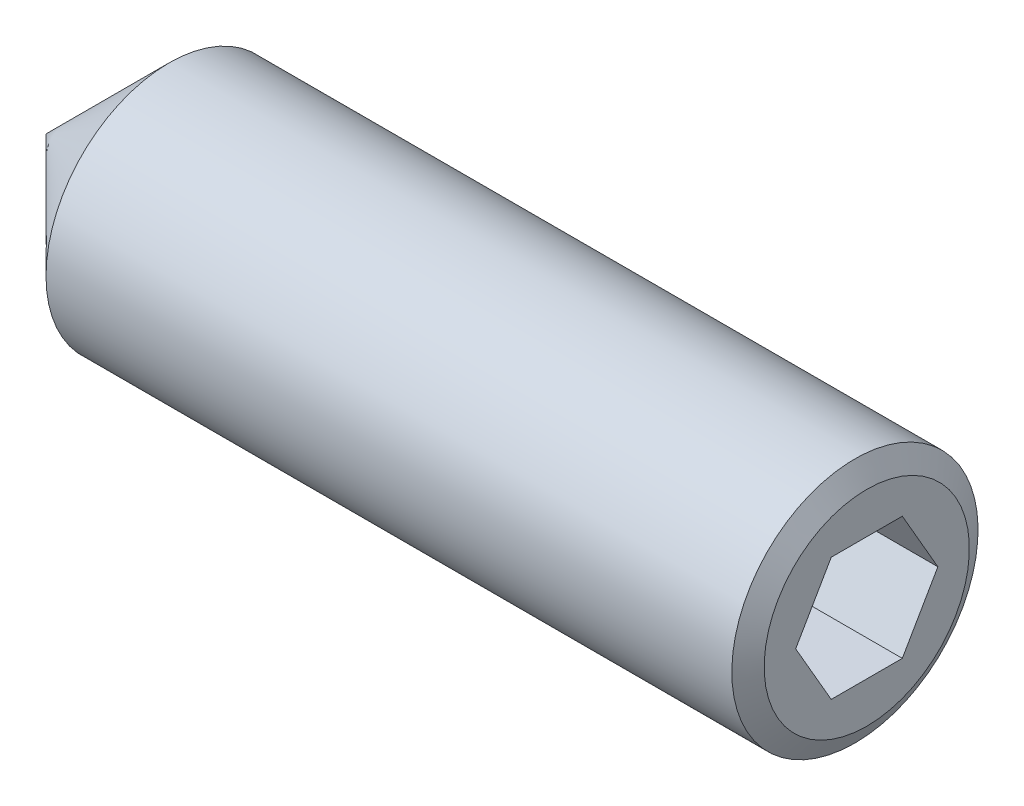
from build123d import *

# Parameters (mm, degrees)
CUT_EXTRUDE1_DEPTH = 3.5
CHAMFER1_SIZE      = 0.288675135
CHAMFER1_SIZE2     = 0.5


with BuildPart() as part:
    # Sketch1 → Revolve1 (revolve)
    with BuildSketch(Plane.XY, mode=Mode.PRIVATE) as revolve1_sk:
        Polygon((0, 0), (3, 3), (20, 3), (20, 0), align=None)
    revolve(revolve1_sk.sketch.rotate(Axis((0, 0, 0), (1, 0, 0)), 180), axis=Axis((0, 0, 0), (1, 0, 0)))

    # Sketch2 → Cut-Extrude1 (cut)
    with BuildSketch(Plane(origin=(20, 0, 0), x_dir=(0, 0, -1), z_dir=(1, 0, 0))):
        Polygon((1.732050808, 0), (0.866025404, 1.5), (-0.866025404, 1.5), (-1.732050808, 0), (-0.866025404, -1.5), (0.866025404, -1.5), align=None)
    extrude(amount=-CUT_EXTRUDE1_DEPTH, mode=Mode.SUBTRACT)

    # Chamfer1
    chamfer1_edges = [part.edges().sort_by_distance(p)[0] for p in [
        (20, 3, 0),
    ]]
    chamfer1_side = [part.faces().sort_by_distance(p)[0] for p in [
        (11.5, 3, 0),
    ]]
    chamfer(chamfer1_edges, length=CHAMFER1_SIZE, length2=CHAMFER1_SIZE2, reference=chamfer1_side[0])


solid = part.part
